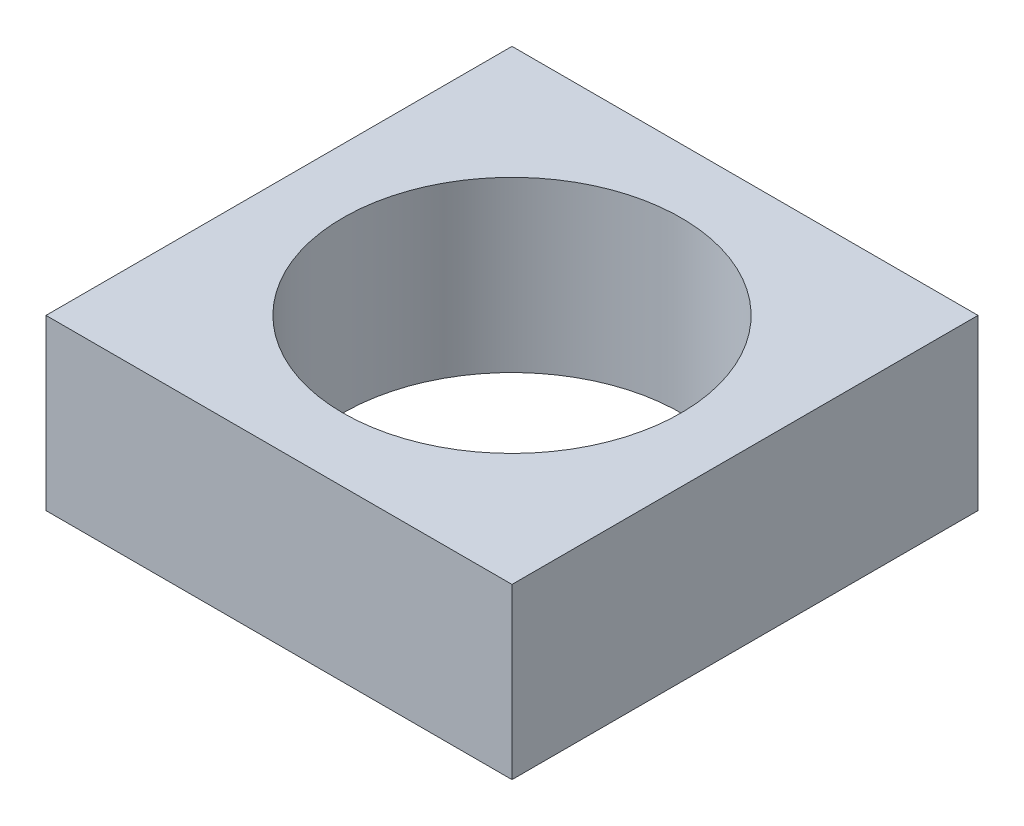
from build123d import *

# Parameters (mm, degrees)
SKETCH1_W           = 35
SKETCH1_H           = 35
SKETCH1_R           = 12.7
BOSS_EXTRUDE1_DEPTH = 12.7


with BuildPart() as part:
    # Sketch1 → Boss-Extrude1 (new body)
    with BuildSketch(Plane(origin=(0, 0, 0), x_dir=(1, 0, 0), z_dir=(0, 1, 0))):
        Rectangle(SKETCH1_W, SKETCH1_H)
        with Locations(Location((0, 0, 0), (0, 0, 270))):
            Circle(SKETCH1_R, mode=Mode.SUBTRACT)
    extrude(amount=BOSS_EXTRUDE1_DEPTH)


solid = part.part
